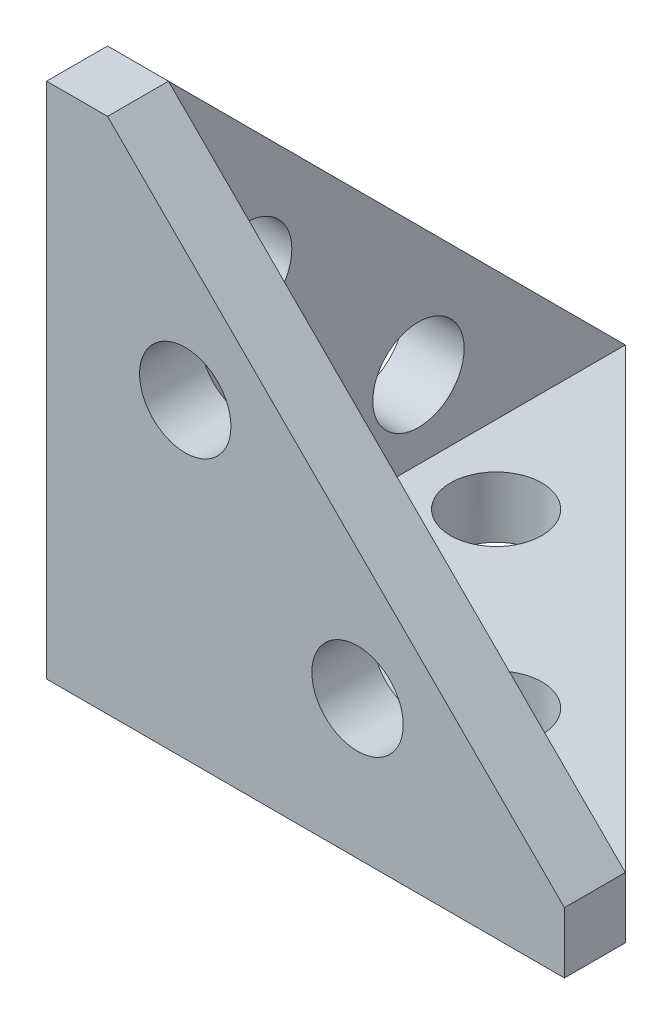
from build123d import *

# Parameters (mm, degrees)
BOSS_EXTRUDE1_DEPTH      = 2
BOSS_EXTRUDE2_DEPTH      = 15
BOSS_EXTRUDE2_DEPTH_BACK = 2
CUT_EXTRUDE1_DEPTH       = 15
CUT_EXTRUDE2_DEPTH       = 15
SKETCH5_R                = 1.5
CUT_EXTRUDE3_DEPTH       = 15
SKETCH6_R                = 1.5
CUT_EXTRUDE4_DEPTH       = 15
SKETCH7_R                = 1.5
CUT_EXTRUDE5_DEPTH       = 15


with BuildPart() as part:
    # Sketch1 → Boss-Extrude1 (new body)
    with BuildSketch(Plane(origin=(0, 0, 0), x_dir=(1, 0, 0), z_dir=(0, 1, 0))):
        Polygon((0, 15), (15, 0), (0, 0), align=None)
    extrude(amount=BOSS_EXTRUDE1_DEPTH)

    # Sketch2 → Boss-Extrude2 (add, two sides: drawn at the far end of the back side and taken through both)
    with BuildSketch(Plane(origin=(0, 2, 0), x_dir=(1, 0, 0), z_dir=(0, 1, 0)).offset(-BOSS_EXTRUDE2_DEPTH_BACK)):
        Polygon((-2, -2), (15, -2), (15, 0), (0, 0), (0, 15), (-2, 15), align=None)
    extrude(amount=BOSS_EXTRUDE2_DEPTH + BOSS_EXTRUDE2_DEPTH_BACK)

    # Sketch3 → Cut-Extrude1 (cut)
    with BuildSketch(Plane(origin=(0, 0, 0), x_dir=(0, 0, -1), z_dir=(1, 0, 0))):
        Polygon((15, 2), (0, 17), (15, 17), align=None)
    extrude(amount=-CUT_EXTRUDE1_DEPTH, mode=Mode.SUBTRACT)

    # Sketch4 → Cut-Extrude2 (cut)
    with BuildSketch(Plane(origin=(0, 0, 0), x_dir=(-1, 0, 0), z_dir=(0, 0, -1))):
        Polygon((0, 17), (-15, 2), (-15, 17), align=None)
    extrude(amount=-CUT_EXTRUDE2_DEPTH, mode=Mode.SUBTRACT)

    # Sketch5 → Cut-Extrude3 (cut)
    with BuildSketch(Plane(origin=(0, 0, 0), x_dir=(0, 0, -1), z_dir=(1, 0, 0))):
        with Locations((2.550252532, 10.207106781)):
            Circle(SKETCH5_R)
        with Locations((8.207106781, 4.550252532)):
            Circle(SKETCH5_R)
    extrude(amount=-CUT_EXTRUDE3_DEPTH, mode=Mode.SUBTRACT)

    # Sketch6 → Cut-Extrude4 (cut)
    with BuildSketch(Plane(origin=(0, 0, 0), x_dir=(-1, 0, 0), z_dir=(0, 0, -1))):
        with Locations((-2.550252532, 10.207106781)):
            Circle(SKETCH6_R)
        with Locations((-8.207106781, 4.550252532)):
            Circle(SKETCH6_R)
    extrude(amount=-CUT_EXTRUDE4_DEPTH, mode=Mode.SUBTRACT)

    # Sketch7 → Cut-Extrude5 (cut)
    with BuildSketch(Plane(origin=(0, 2, 0), x_dir=(1, 0, 0), z_dir=(0, 1, 0))):
        with Locations(Location((2.550252532, 8.207106781, 0), (0, 0, 270))):
            Circle(SKETCH7_R)
        with Locations(Location((8.207106781, 2.550252532, 0), (0, 0, 270))):
            Circle(SKETCH7_R)
    extrude(amount=-CUT_EXTRUDE5_DEPTH, mode=Mode.SUBTRACT)


solid = part.part
